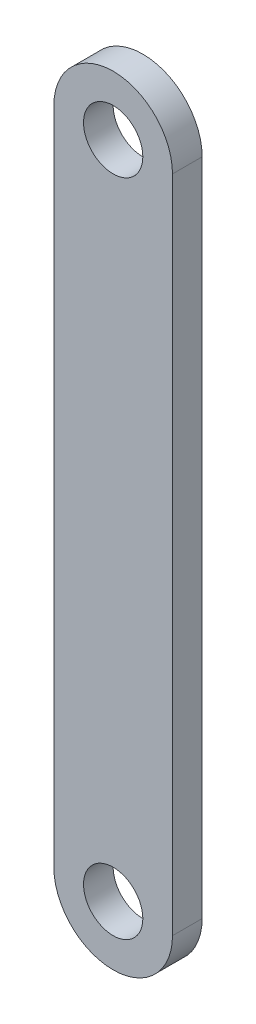
from build123d import *

# Parameters (mm, degrees)
MODEL_R        = 1
EXTRUDE1_DEPTH = 1


with BuildPart() as part:
    # Model → Extrude1 (new body)
    with BuildSketch(Plane.XY):
        with BuildLine():
            Line((-2, 22.2444), (-2, 0))
            ThreePointArc((-2, 0), (0, -2), (2, 0))
            Line((2, 0), (2, 22.2444))
            ThreePointArc((2, 22.2444), (0, 24.2444), (-2, 22.2444))
        make_face()
        with Locations((0, 22.2444)):
            Circle(MODEL_R, mode=Mode.SUBTRACT)
        Circle(MODEL_R, mode=Mode.SUBTRACT)
    extrude(amount=EXTRUDE1_DEPTH)


solid = part.part
